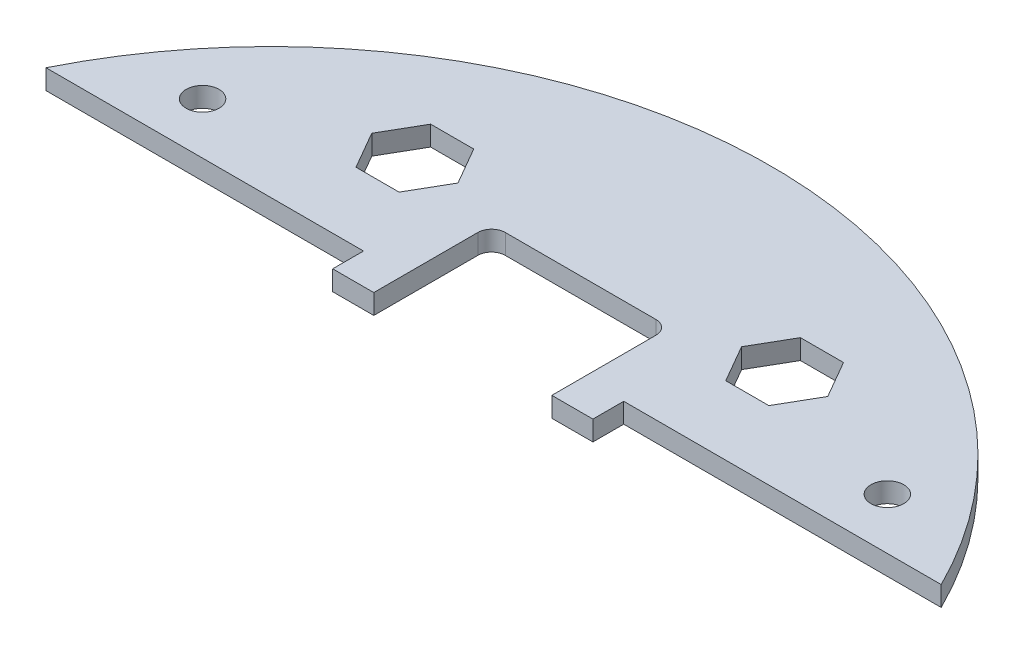
from build123d import *

# Parameters (mm, degrees)
BOSS_EXTRUDE1_DEPTH  = 2.9
SOLENOID_PLACEMENT_W = 38
SOLENOID_PLACEMENT_H = 64
CUT_EXTRUDE1_DEPTH   = 104.278313309
CUT_EXTRUDE4_DEPTH   = 104.278313309
CUT_EXTRUDE5_DEPTH   = 104.278313309
SKETCH6_R            = 2.4
CUT_EXTRUDE6_DEPTH   = 104.278313309
CUT_EXTRUDE3_DEPTH   = 104.278313309
SKETCH7_W            = 10
SKETCH7_H            = 62.80248699
CUT_EXTRUDE7_DEPTH   = 99.031423533


with BuildPart() as part:
    # Sketch1 → Boss-Extrude1 (new body)
    with BuildSketch(Plane(origin=(0, 0, 0), x_dir=(1, 0, 0), z_dir=(0, 1, 0))):
        with BuildLine():
            ThreePointArc((36.856602833, -63.012624351), (0, 73), (-36.856602833, -63.012624351))
            ThreePointArc((-36.856602833, -63.012624351), (-33.368752207, -63.602994345), (-30.363140064, -61.737536127))
            ThreePointArc((-30.363140064, -61.737536127), (0, -46.75), (30.363140064, -61.737536127))
            ThreePointArc((30.363140064, -61.737536127), (33.368752207, -63.602994345), (36.856602833, -63.012624351))
        make_face()
    extrude(amount=BOSS_EXTRUDE1_DEPTH)

    # solenoid placement → Cut-Extrude1 (cut, through all)
    with BuildSketch(Plane(origin=(0, 2.9, 0), x_dir=(1, 0, 0), z_dir=(0, 1, 0))):
        with Locations((0, -4)):
            Rectangle(SOLENOID_PLACEMENT_W, SOLENOID_PLACEMENT_H)
    extrude(amount=-CUT_EXTRUDE1_DEPTH, mode=Mode.SUBTRACT)

    # Sketch4 → Cut-Extrude4 (cut, through all)
    with BuildSketch(Plane(origin=(0, 2.9, 0), x_dir=(1, 0, 0), z_dir=(0, 1, 0))):
        with BuildLine():
            Line((-13, 28), (13, 28))
            Line((13, 28), (13, 43.2))
            ThreePointArc((13, 43.2), (12.414213562, 44.614213562), (11, 45.2))
            Line((11, 45.2), (-11, 45.2))
            ThreePointArc((-11, 45.2), (-12.414213562, 44.614213562), (-13, 43.2))
            Line((-13, 43.2), (-13, 28))
        make_face()
    extrude(amount=-CUT_EXTRUDE4_DEPTH, mode=Mode.SUBTRACT)

    # Sketch5 → Cut-Extrude5 (cut, through all)
    with BuildSketch(Plane(origin=(0, 2.9, 0), x_dir=(1, 0, 0), z_dir=(0, 1, 0))):
        Polygon((-20.706882066, 48), (-23.853441033, 53.45), (-30.146558967, 53.45), (-33.293117934, 48), (-30.146558967, 42.55), (-23.853441033, 42.55), align=None)
        Polygon((23.853441033, 42.55), (20.706882066, 48), (23.853441033, 53.45), (30.146558967, 53.45), (33.293117934, 48), (30.146558967, 42.55), align=None)
    extrude(amount=-CUT_EXTRUDE5_DEPTH, mode=Mode.SUBTRACT)

    # Sketch6 → Cut-Extrude6 (cut, through all)
    with BuildSketch(Plane(origin=(0, 2.9, 0), x_dir=(1, 0, 0), z_dir=(0, 1, 0))):
        with Locations(Location((40, -40, 0), (0, 0, 270))):
            Circle(SKETCH6_R)
        with Locations(Location((-40, -40, 0), (0, 0, 270))):
            Circle(SKETCH6_R)
        with Locations(Location((-50, 40, 0), (0, 0, 270))):
            Circle(SKETCH6_R)
        with Locations(Location((50, 40, 0), (0, 0, 270))):
            Circle(SKETCH6_R)
    extrude(amount=-CUT_EXTRUDE6_DEPTH, mode=Mode.SUBTRACT)

    # Sketch3 → Cut-Extrude3 (cut, through all)
    with BuildSketch(Plane(origin=(0, 2.9, 0), x_dir=(1, 0, 0), z_dir=(0, 1, 0))):
        Polygon((-19, 28), (19, 28), (19, 32.5), (73, 32.5), (73, -32.5), (-73, -32.5), (-73, 32.5), (-19, 32.5), align=None)
    extrude(amount=-CUT_EXTRUDE3_DEPTH, mode=Mode.SUBTRACT)


with BuildPart() as cut_extrude3_piece_1:
    # of the separate pieces the step leaves, piece 1, a body of its own (cut_extrude3_pieces)
    add(part.part.solids().sort_by_distance((65.366275709, 0, -32.5))[0])


with BuildPart() as cut_extrude3_piece_2:
    # of the separate pieces the step leaves, piece 2, a body of its own (cut_extrude3_pieces)
    add(part.part.solids().sort_by_distance((-36.856602833, 0, 63.012624351))[0])

    # Sketch7 → Cut-Extrude7 (cut, through all)
    with BuildSketch(Plane(origin=(0, 2.9, 0), x_dir=(1, 0, 0), z_dir=(0, 1, 0))):
        with Locations((0, -31.401243495)):
            Rectangle(SKETCH7_W, SKETCH7_H)
    extrude(amount=-CUT_EXTRUDE7_DEPTH, mode=Mode.SUBTRACT)


with BuildPart() as cut_extrude7_piece_1:
    # of the separate pieces the step leaves, piece 1, a body of its own (cut_extrude7_pieces)
    add(cut_extrude3_piece_2.part.solids().sort_by_distance((5, 0, 47.078205475))[0])


with BuildPart() as cut_extrude7_piece_2:
    # of the separate pieces the step leaves, piece 2, a body of its own (cut_extrude7_pieces)
    add(cut_extrude3_piece_2.part.solids().sort_by_distance((-36.856602833, 0, 63.012624351))[0])


solid = cut_extrude3_piece_1.part
